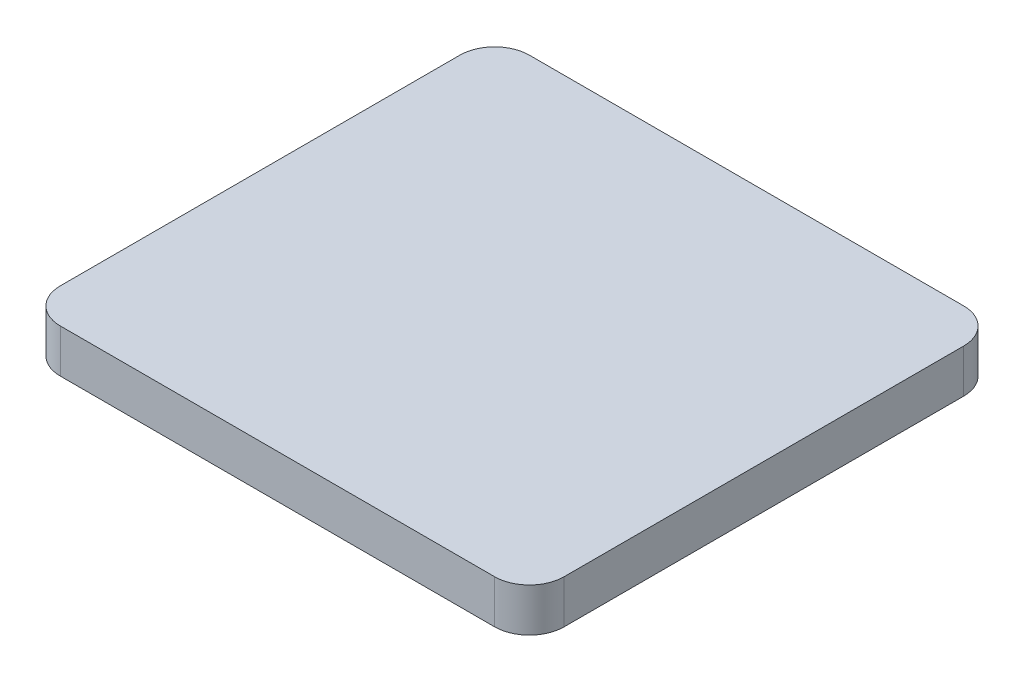
from build123d import *

# Parameters (mm, degrees)
BOSS_EXTRUDE1_DEPTH = 25


with BuildPart() as part:
    # Sketch1 → Boss-Extrude1 (new body)
    with BuildSketch(Plane(origin=(0, 0, 0), x_dir=(1, 0, 0), z_dir=(0, 1, 0))):
        with BuildLine():
            Line((-125, 270), (125, 270))
            ThreePointArc((125, 270), (139.142135624, 264.142135624), (145, 250))
            Line((145, 250), (145, 20))
            ThreePointArc((145, 20), (139.142135624, 5.857864376), (125, 0))
            Line((125, 0), (-125, 0))
            ThreePointArc((-125, 0), (-139.142135624, 5.857864376), (-145, 20))
            Line((-145, 20), (-145, 250))
            ThreePointArc((-145, 250), (-139.142135624, 264.142135624), (-125, 270))
        make_face()
    extrude(amount=BOSS_EXTRUDE1_DEPTH)


solid = part.part
